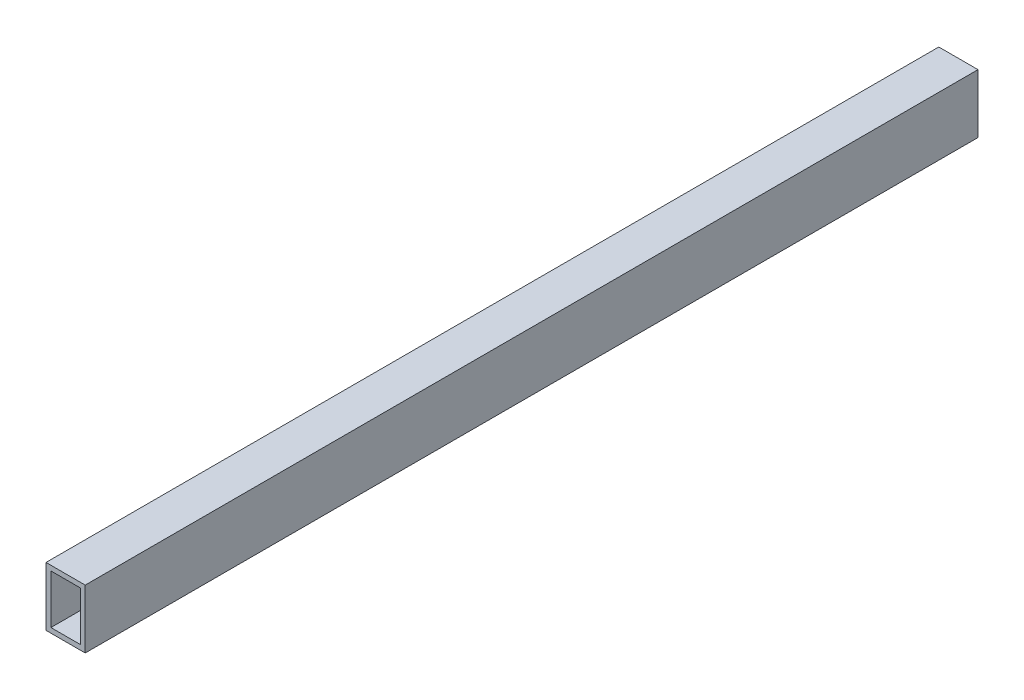
from build123d import *

# Parameters (mm, degrees)
SKETCH2_W           = 25.4
SKETCH2_H           = 38.1
SKETCH2_W_2         = 19.05
SKETCH2_H_2         = 31.75
BOSS_EXTRUDE1_DEPTH = 578.104


with BuildPart() as part:
    # Sketch2 → Boss-Extrude1 (new body)
    with BuildSketch(Plane.XY):
        Rectangle(SKETCH2_W, SKETCH2_H)
        Rectangle(SKETCH2_W_2, SKETCH2_H_2, mode=Mode.SUBTRACT)
    extrude(amount=BOSS_EXTRUDE1_DEPTH)


solid = part.part
